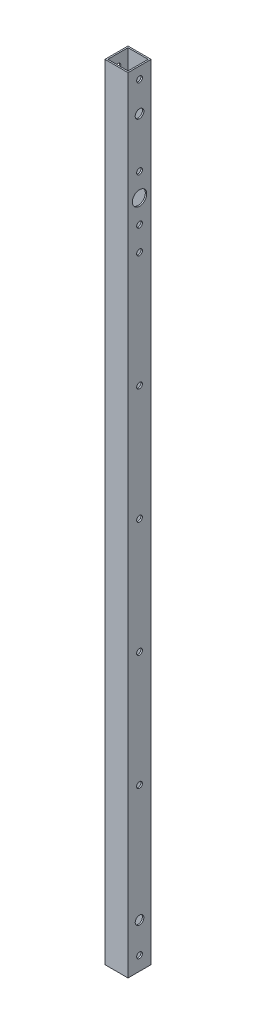
from build123d import *

# Parameters (mm, degrees)
SKETCH1_W                    = 25.4
SKETCH1_H                    = 25.4
SKETCH1_W_2                  = 22.225
SKETCH1_H_2                  = 22.225
BOSS_EXTRUDE1_DEPTH          = 863.6
F_1_4_0_25_DIAMETER_HOLE1_D  = 6.35
F_3_8_0_375_DIAMETER_HOLE1_D = 9.525
F_5_8_0_625_DIAMETER_HOLE1_D = 15.875
F_1_4_0_25_DIAMETER_HOLE2_D  = 6.35


with BuildPart() as part:
    # Sketch1 → Boss-Extrude1 (new body)
    with BuildSketch(Plane(origin=(0, 0, 0), x_dir=(1, 0, 0), z_dir=(0, 1, 0))):
        Rectangle(SKETCH1_W, SKETCH1_H)
        Rectangle(SKETCH1_W_2, SKETCH1_H_2, mode=Mode.SUBTRACT)
    extrude(amount=BOSS_EXTRUDE1_DEPTH)

    # 1/4 (0.25) Diameter Hole1 (through all)
    with Locations(Plane(origin=(12.7, 0, 0), x_dir=(0, 0, -1), z_dir=(1, 0, 0))):
        with Locations((0, 177.8), (0, 850.9), (0, 15.398282467), (0, 431.8), (0, 558.8), (0, 685.8), (0, 304.8)):
            Hole(F_1_4_0_25_DIAMETER_HOLE1_D / 2)

    # 3/8 (0.375) Diameter Hole1 (through all)
    with Locations(Plane(origin=(12.7, 0, 0), x_dir=(0, 0, -1), z_dir=(1, 0, 0))):
        with Locations((0, 48.900570065), (0, 818.04497499)):
            Hole(F_3_8_0_375_DIAMETER_HOLE1_D / 2)

    # 5/8 (0.625) Diameter Hole1 (through all)
    with Locations(Plane(origin=(12.7, 0, 0), x_dir=(0, 0, -1), z_dir=(1, 0, 0))):
        with Locations((0, 737.710800359)):
            Hole(F_5_8_0_625_DIAMETER_HOLE1_D / 2)

    # 1/4 (0.25) Diameter Hole2 (through all)
    with Locations(Plane(origin=(12.7, 0, 0), x_dir=(0, 0, -1), z_dir=(1, 0, 0))):
        with Locations((0, 712.310800359), (0, 763.110800359)):
            Hole(F_1_4_0_25_DIAMETER_HOLE2_D / 2)


solid = part.part
